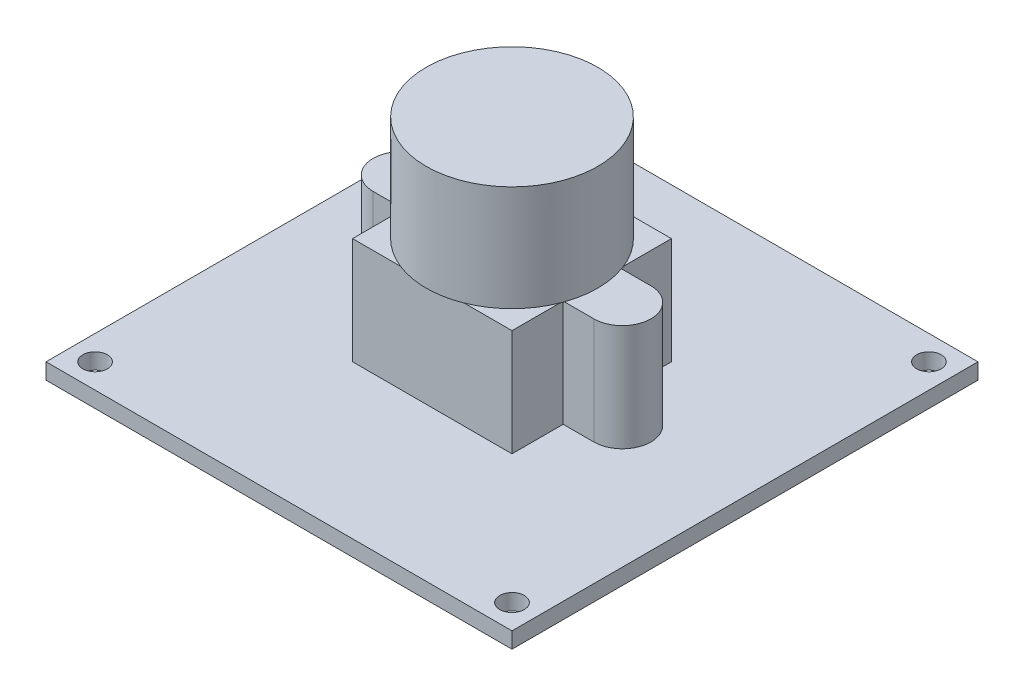
from build123d import *

# Parameters (mm, degrees)
SKETCH1_W           = 38
SKETCH1_H           = 38
SKETCH1_R           = 1
BOSS_EXTRUDE1_DEPTH = 1.3
BOSS_EXTRUDE2_DEPTH = 8.7
SKETCH3_R           = 7
BOSS_EXTRUDE3_DEPTH = 8.6


with BuildPart() as part:
    # Sketch1 → Boss-Extrude1 (new body)
    with BuildSketch(Plane(origin=(0, 0, 0), x_dir=(1, 0, 0), z_dir=(0, 1, 0))):
        with Locations((4.613461538, -5.005769231)):
            Rectangle(SKETCH1_W, SKETCH1_H)
        with Locations((-12.386538462, 11.994230769)):
            Circle(SKETCH1_R, mode=Mode.SUBTRACT)
        with Locations((21.613461538, 11.994230769)):
            Circle(SKETCH1_R, mode=Mode.SUBTRACT)
        with Locations((21.613461538, -22.005769231)):
            Circle(SKETCH1_R, mode=Mode.SUBTRACT)
        with Locations((-12.386538462, -22.005769231)):
            Circle(SKETCH1_R, mode=Mode.SUBTRACT)
    extrude(amount=BOSS_EXTRUDE1_DEPTH)

    # Sketch2 → Boss-Extrude2 (add)
    with BuildSketch(Plane(origin=(0, 1.3, 0), x_dir=(1, 0, 0), z_dir=(0, 1, 0))):
        with BuildLine():
            Line((-1.886538462, -11.505769231), (11.113461538, -11.505769231))
            Line((11.113461538, -11.505769231), (11.113461538, -7.333742244))
            Line((11.113461538, -7.333742244), (13.613461538, -7.333742244))
            ThreePointArc((13.613461538, -7.333742244), (15.941434552, -5.005769231), (13.613461538, -2.677796217))
            Line((13.613461538, -2.677796217), (11.113461538, -2.677796217))
            Line((11.113461538, -2.677796217), (11.113461538, 1.494230769))
            Line((11.113461538, 1.494230769), (-1.886538462, 1.494230769))
            Line((-1.886538462, 1.494230769), (-1.886538462, -2.677796217))
            Line((-1.886538462, -2.677796217), (-4.386538462, -2.677796217))
            ThreePointArc((-4.386538462, -2.677796217), (-6.714511475, -5.005769231), (-4.386538462, -7.333742244))
            Line((-4.386538462, -7.333742244), (-1.886538462, -7.333742244))
            Line((-1.886538462, -7.333742244), (-1.886538462, -11.505769231))
        make_face()
    extrude(amount=BOSS_EXTRUDE2_DEPTH)

    # Sketch3 → Boss-Extrude3 (add)
    with BuildSketch(Plane(origin=(0, 10, 0), x_dir=(1, 0, 0), z_dir=(0, 1, 0))):
        with Locations((4.613461538, -5.005769231)):
            Circle(SKETCH3_R)
    extrude(amount=BOSS_EXTRUDE3_DEPTH)


solid = part.part
